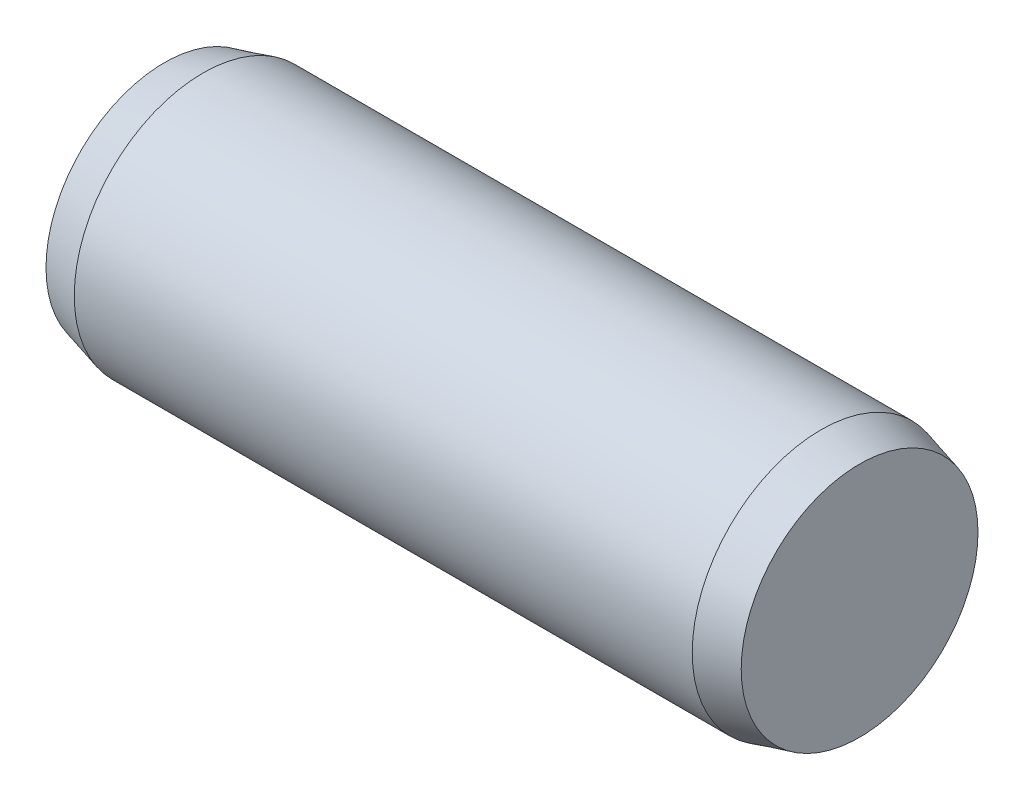
from build123d import *

# Parameters (mm, degrees)
EXTRUDE1_DEPTH      = 6
EXTRUDE1_DEPTH_BACK = 6
SKETCH2_R           = 2.5
SKETCH3_R           = 2.5
EXTRUDE2_DEPTH      = 0.75
EXTRUDE2_TAPER      = 15
SKETCH4_R           = 2.5
EXTRUDE3_DEPTH      = 0.75
EXTRUDE3_TAPER      = 15


with BuildPart() as part:
    # Sketch2 → Extrude1 (new, two sides: drawn at the far end of the back side and taken through both)
    with BuildSketch(Plane(origin=(0, 0, 0), x_dir=(0, 0, -1), z_dir=(1, 0, 0)).offset(-EXTRUDE1_DEPTH_BACK)):
        Circle(SKETCH2_R)
    extrude(amount=EXTRUDE1_DEPTH + EXTRUDE1_DEPTH_BACK)

    # Sketch3 → Extrude2 (add)
    with BuildSketch(Plane(origin=(6, 0, 0), x_dir=(0, 0, -1), z_dir=(1, 0, 0))):
        Circle(SKETCH3_R)
    extrude(amount=EXTRUDE2_DEPTH, taper=EXTRUDE2_TAPER)

    # Sketch4 → Extrude3 (add)
    with BuildSketch(Plane.ZY.offset(6)):
        with Locations(Location((0, 0, 0), (0, 0, 180))):
            Circle(SKETCH4_R)
    extrude(amount=EXTRUDE3_DEPTH, taper=EXTRUDE3_TAPER)


solid = part.part
